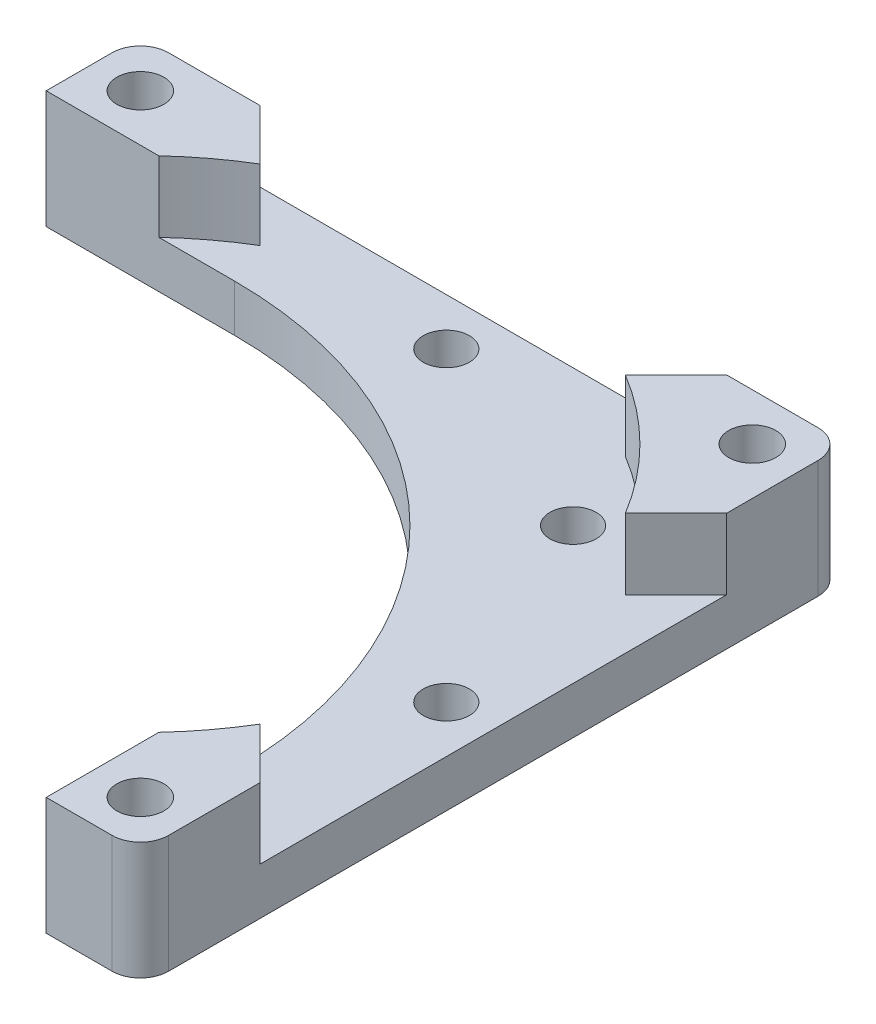
from build123d import *

# Parameters (mm, degrees)
SKETCH1_W               = 190.5
SKETCH1_H               = 190.5
BOSS_EXTRUDE1_DEPTH     = 12.7
FILLET1_R               = 7.62
BOSS_EXTRUDE3_START     = 19.05
BOSS_EXTRUDE3_DEPTH     = 19.05
CIRPATTERN1_COUNT       = 4
SKETCH8_R               = 6.223
CUT_EXTRUDE2_DEPTH      = 25.4
CUT_EXTRUDE3_DEPTH      = 137.044211564
CUT_EXTRUDE3_DEPTH_BACK = 137.044211564
SKETCH10_R              = 6.223
FILLET2_R               = 12.7
SKETCH11_R              = 6.35
CUT_EXTRUDE4_DEPTH      = 19.05
SKETCH11_3_R            = 3.2385
CUT_EXTRUDE5_DEPTH      = 139.395041457
CIRPATTERN2_COUNT       = 4
CUT_EXTRUDE6_DEPTH      = 137.044211564
CUT_EXTRUDE6_DEPTH_BACK = 137.044211564
CUT_EXTRUDE7_DEPTH      = 137.044211564
CUT_EXTRUDE7_DEPTH_BACK = 137.044211564


with BuildPart() as part:
    # Sketch1 → Boss-Extrude1 (new body)
    with BuildSketch(Plane(origin=(0, 0, 0), x_dir=(1, 0, 0), z_dir=(0, 1, 0))):
        Rectangle(SKETCH1_W, SKETCH1_H)
    extrude(amount=BOSS_EXTRUDE1_DEPTH)

    # Fillet1
    fillet1_edges = [part.edges().sort_by_distance(p)[0] for p in [
        (95.25, 6.35, 95.25),
        (-95.25, 6.35, 95.25),
        (-95.25, 6.35, -95.25),
        (95.25, 6.35, -95.25),
    ]]
    fillet(fillet1_edges, radius=FILLET1_R)

    # Sketch7 → Boss-Extrude3 (add)
    with BuildSketch(Plane(origin=(0, 12.7, 0), x_dir=(1, 0, 0), z_dir=(0, 1, 0)).offset(BOSS_EXTRUDE3_START)):
        with BuildLine():
            Line((67.396822189, 67.396822189), (93.018153673, 93.018153673))
            ThreePointArc((93.018153673, 93.018153673), (90.546047755, 94.669962038), (87.63, 95.25))
            Line((87.63, 95.25), (62.921077964, 95.25))
            Line((62.921077964, 95.25), (49.265209936, 81.594131972))
            ThreePointArc((49.265209936, 81.594131972), (58.761367718, 75.045086089), (67.396822189, 67.396822189))
        make_face()
        with BuildLine():
            ThreePointArc((95.25, 87.63), (94.669962038, 90.546047755), (93.018153673, 93.018153673))
            Line((93.018153673, 93.018153673), (67.396822189, 67.396822189))
            ThreePointArc((67.396822189, 67.396822189), (75.045086089, 58.761367718), (81.594131972, 49.265209936))
            Line((81.594131972, 49.265209936), (95.25, 62.921077964))
            Line((95.25, 62.921077964), (95.25, 87.63))
        make_face()
    boss_extrude3 = extrude(amount=-BOSS_EXTRUDE3_DEPTH)

    # CirPattern1: Boss-Extrude3 ×4 about axis
    cirpattern1_axis = Axis((0, 0, 0), (0, 1, 0))
    for i in range(1, CIRPATTERN1_COUNT):
        add(boss_extrude3.rotate(cirpattern1_axis, i * 360 / CIRPATTERN1_COUNT))

    # Sketch8 → Cut-Extrude2 (cut)
    with BuildSketch(Plane(origin=(0, 12.7, 0), x_dir=(1, 0, 0), z_dir=(0, 1, 0))):
        with Locations(Location((0, 82.55, 0), (0, 0, 270))):
            Circle(SKETCH8_R)
        with Locations(Location((58.371664787, 58.371664787, 0), (0, 0, 270))):
            Circle(SKETCH8_R)
        with Locations(Location((82.55, 0, 0), (0, 0, 270))):
            Circle(SKETCH8_R)
        with Locations(Location((58.371664787, -58.371664787, 0), (0, 0, 270))):
            Circle(SKETCH8_R)
        with Locations(Location((0, -82.55, 0), (0, 0, 270))):
            Circle(SKETCH8_R)
        with Locations(Location((-58.371664787, -58.371664787, 0), (0, 0, 270))):
            Circle(SKETCH8_R)
        with Locations(Location((-82.55, 0, 0), (0, 0, 270))):
            Circle(SKETCH8_R)
        with Locations(Location((-58.371664787, 58.371664787, 0), (0, 0, 270))):
            Circle(SKETCH8_R)
    extrude(amount=-CUT_EXTRUDE2_DEPTH, mode=Mode.SUBTRACT)

    # Sketch10 → Cut-Extrude3 (cut, two sides: drawn at the far end of the back side and taken through both)
    # profile 1 of 2: a face of its own
    with BuildSketch(Plane(origin=(0, 12.7, 0), x_dir=(1, 0, 0), z_dir=(0, 1, 0)).offset(-CUT_EXTRUDE3_DEPTH_BACK)):
        Polygon((38.1, 38.1), (-95.25, 38.1), (-95.25, -38.1), (-38.1, -38.1), (-38.1, -95.25), (38.1, -95.25), align=None)
        with Locations((-82.55, 0)):
            Circle(SKETCH10_R, mode=Mode.SUBTRACT)
        with Locations((0, -82.55)):
            Circle(SKETCH10_R, mode=Mode.SUBTRACT)
    # profile 2 of 2: a face of its own
    with BuildSketch(Plane(origin=(0, 12.7, 0), x_dir=(1, 0, 0), z_dir=(0, 1, 0)).offset(-CUT_EXTRUDE3_DEPTH_BACK)):
        with BuildLine():
            Line((-38.1, -38.1), (-95.25, -38.1))
            Line((-95.25, -38.1), (-95.25, -62.921077964))
            Line((-95.25, -62.921077964), (-81.594131972, -49.265209936))
            ThreePointArc((-81.594131972, -49.265209936), (-67.396822189, -67.396822189), (-49.265209936, -81.594131972))
            Line((-49.265209936, -81.594131972), (-62.921077964, -95.25))
            Line((-62.921077964, -95.25), (-38.1, -95.25))
            Line((-38.1, -95.25), (-38.1, -38.1))
        make_face()
        with Locations((-58.371664787, -58.371664787)):
            Circle(SKETCH10_R, mode=Mode.SUBTRACT)
    extrude(amount=CUT_EXTRUDE3_DEPTH + CUT_EXTRUDE3_DEPTH_BACK, mode=Mode.SUBTRACT)


with BuildPart() as cut_extrude3_kept_piece:
    # of the separate pieces the step leaves, the one the design keeps (cut_extrude3_pieces_kept)
    add(part.part.solids().sort_by_distance((38.1, 0, 95.25))[0])

    # Fillet2
    fillet2_edges = [cut_extrude3_kept_piece.edges().sort_by_distance(p)[0] for p in [
        (-95.25, 6.35, -38.1),
        (38.1, 6.35, -38.1),
        (38.1, 6.35, 95.25),
    ]]
    fillet(fillet2_edges, radius=FILLET2_R)

    # Sketch11 → Cut-Extrude4 (cut)
    with BuildSketch(Plane(origin=(0, 31.75, 0), x_dir=(1, 0, 0), z_dir=(0, 1, 0))):
        with Locations(Location((82.55, 82.55, 0), (0, 0, 270))):
            Circle(SKETCH11_R)
    cut_extrude4 = extrude(amount=-CUT_EXTRUDE4_DEPTH, mode=Mode.SUBTRACT)

    # Sketch11<3> → Cut-Extrude5 (cut, through all)
    with BuildSketch(Plane(origin=(0, 31.75, 0), x_dir=(1, 0, 0), z_dir=(0, 1, 0))):
        with Locations(Location((82.55, 82.55, 0), (0, 0, 270))):
            Circle(SKETCH11_3_R)
    cut_extrude5 = extrude(amount=-CUT_EXTRUDE5_DEPTH, mode=Mode.SUBTRACT)

    # CirPattern2: Cut-Extrude4, Cut-Extrude5 ×4 about axis
    cirpattern2_axis = Axis((0, 0, 0), (0, 1, 0))
    add([cut_extrude4.rotate(cirpattern2_axis, i * 360 / CIRPATTERN2_COUNT) for i in range(1, CIRPATTERN2_COUNT)], mode=Mode.SUBTRACT)
    add([cut_extrude5.rotate(cirpattern2_axis, i * 360 / CIRPATTERN2_COUNT) for i in range(1, CIRPATTERN2_COUNT)], mode=Mode.SUBTRACT)

    # Sketch12 → Cut-Extrude6 (cut, two sides: drawn at the far end of the back side and taken through both)
    with BuildSketch(Plane(origin=(0, 12.7, 0), x_dir=(1, 0, 0), z_dir=(0, 1, 0)).offset(-CUT_EXTRUDE6_DEPTH_BACK)):
        Polygon((-95.25, -95.25), (69.85, -95.25), (69.85, -44.45), (-44.45, -44.45), (-44.45, 69.85), (-95.25, 69.85), align=None)
    extrude(amount=CUT_EXTRUDE6_DEPTH + CUT_EXTRUDE6_DEPTH_BACK, mode=Mode.SUBTRACT)

    # Sketch13 → Cut-Extrude7 (cut, two sides: drawn at the far end of the back side and taken through both)
    with BuildSketch(Plane(origin=(0, 12.7, 0), x_dir=(1, 0, 0), z_dir=(0, 1, 0)).offset(-CUT_EXTRUDE7_DEPTH_BACK)):
        with BuildLine():
            Line((-44.45, 69.85), (-44.45, -44.45))
            Line((-44.45, -44.45), (69.85, -44.45))
            ThreePointArc((69.85, -44.45), (36.37230509, 36.37230509), (-44.45, 69.85))
        make_face()
    extrude(amount=CUT_EXTRUDE7_DEPTH + CUT_EXTRUDE7_DEPTH_BACK, mode=Mode.SUBTRACT)


solid = cut_extrude3_kept_piece.part
